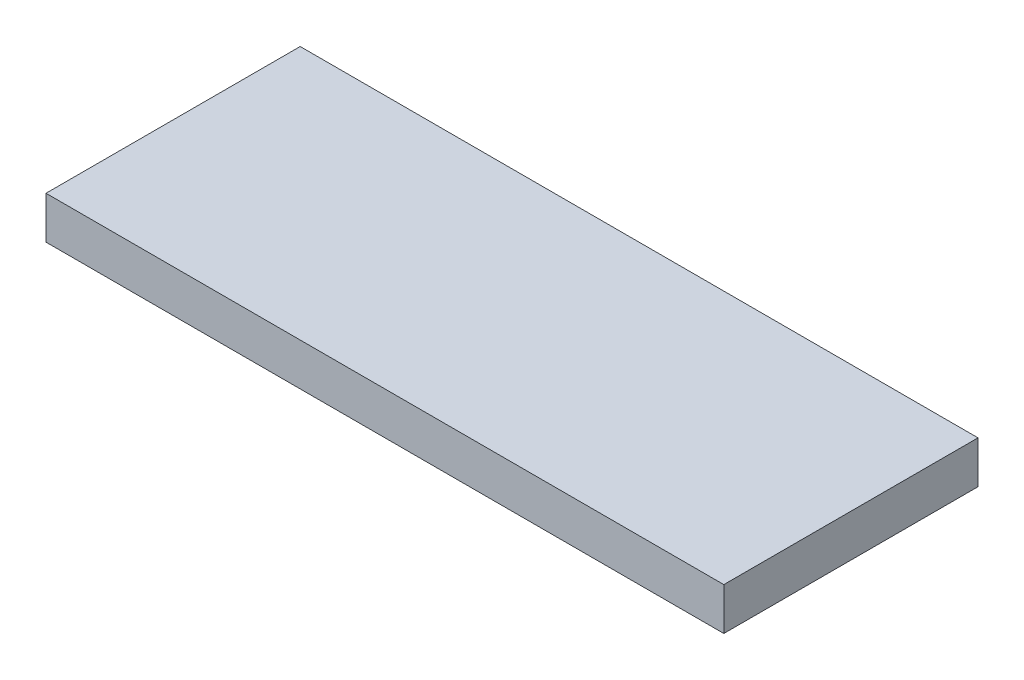
from build123d import *

# Parameters (mm, degrees)
SKETCH1_W           = 160
SKETCH1_H           = 60
BOSS_EXTRUDE1_DEPTH = 10


with BuildPart() as part:
    # Sketch1 → Boss-Extrude1 (new body)
    with BuildSketch(Plane(origin=(0, 0, 0), x_dir=(1, 0, 0), z_dir=(0, 1, 0))):
        Rectangle(SKETCH1_W, SKETCH1_H)
    extrude(amount=BOSS_EXTRUDE1_DEPTH)


solid = part.part
